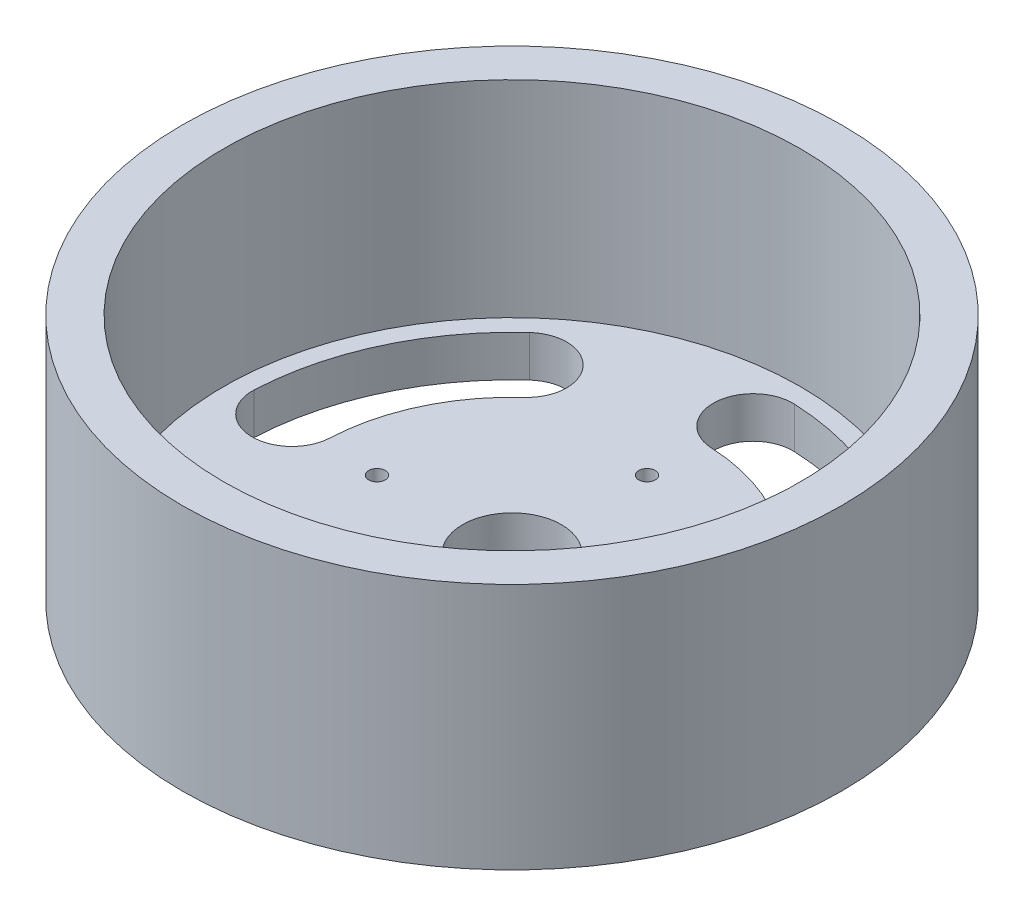
from build123d import *

# Parameters (mm, degrees)
SKETCH1_R           = 40
BOSS_EXTRUDE1_DEPTH = 30
SKETCH2_R           = 35
CUT_EXTRUDE1_DEPTH  = 25
CUT_EXTRUDE2_REACH  = 66.031
SKETCH4_R           = 6
SKETCH4_R_2         = 1


with BuildPart() as part:
    # Sketch1 → Boss-Extrude1 (new body)
    with BuildSketch(Plane(origin=(0, 0, 0), x_dir=(1, 0, 0), z_dir=(0, 1, 0))):
        with Locations(Location((0, 0, 0), (0, 0, 270))):
            Circle(SKETCH1_R)
    extrude(amount=BOSS_EXTRUDE1_DEPTH)

    # Sketch2 → Cut-Extrude1 (cut)
    with BuildSketch(Plane(origin=(0, 30, 0), x_dir=(1, 0, 0), z_dir=(0, 1, 0))):
        with Locations(Location((0, 0, 0), (0, 0, 270))):
            Circle(SKETCH2_R)
    extrude(amount=-CUT_EXTRUDE1_DEPTH, mode=Mode.SUBTRACT)

    # Sketch4 → Cut-Extrude2 (cut, up to next)
    with BuildSketch(Plane.XZ, mode=Mode.PRIVATE) as cut_extrude2_sk1:
        with Locations(Location((0, 0, 0), (0, 0, 270))):
            Circle(SKETCH4_R)
    cut_extrude2_tool1 = extrude(cut_extrude2_sk1.sketch, amount=-CUT_EXTRUDE2_REACH, mode=Mode.PRIVATE) & part.part
    # Sketch4 → Cut-Extrude2 (cut, up to next)
    with BuildSketch(Plane.XZ, mode=Mode.PRIVATE) as cut_extrude2_sk2:
        with Locations(Location((0, 16.383, 0), (0, 0, 270))):
            Circle(SKETCH4_R_2)
    cut_extrude2_tool2 = extrude(cut_extrude2_sk2.sketch, amount=-CUT_EXTRUDE2_REACH, mode=Mode.PRIVATE) & part.part
    # Sketch4 → Cut-Extrude2 (cut, up to next)
    with BuildSketch(Plane.XZ, mode=Mode.PRIVATE) as cut_extrude2_sk3:
        with Locations(Location((-16.383, 0, 0), (0, 0, 270))):
            Circle(SKETCH4_R_2)
    cut_extrude2_tool3 = extrude(cut_extrude2_sk3.sketch, amount=-CUT_EXTRUDE2_REACH, mode=Mode.PRIVATE) & part.part
    # Sketch4 → Cut-Extrude2 (cut, up to next)
    with BuildSketch(Plane.XZ, mode=Mode.PRIVATE) as cut_extrude2_sk4:
        with Locations(Location((16.383, 0, 0), (0, 0, 270))):
            Circle(SKETCH4_R_2)
    cut_extrude2_tool4 = extrude(cut_extrude2_sk4.sketch, amount=-CUT_EXTRUDE2_REACH, mode=Mode.PRIVATE) & part.part
    # Sketch4 → Cut-Extrude2 (cut, up to next)
    with BuildSketch(Plane.XZ, mode=Mode.PRIVATE) as cut_extrude2_sk5:
        with Locations(Location((0, -16.383, 0), (0, 0, 270))):
            Circle(SKETCH4_R_2)
    cut_extrude2_tool5 = extrude(cut_extrude2_sk5.sketch, amount=-CUT_EXTRUDE2_REACH, mode=Mode.PRIVATE) & part.part
    # Sketch4 → Cut-Extrude2 (cut, up to next)
    with BuildSketch(Plane.XZ, mode=Mode.PRIVATE) as cut_extrude2_sk6:
        with BuildLine():
            ThreePointArc((-1.496156575, 32.793473919), (-13.931787596, 29.72466502), (-24.246430247, 22.130545327))
            ThreePointArc((-24.246430247, 22.130545327), (-23.9352707, 15.31040186), (-17.115127233, 15.621561407))
            ThreePointArc((-17.115127233, 15.621561407), (-9.834203009, 20.982116485), (-1.056110524, 23.148334531))
            ThreePointArc((-1.056110524, 23.148334531), (3.546436145, 28.190927251), (-1.496156575, 32.793473919))
        make_face()
    cut_extrude2_tool6 = extrude(cut_extrude2_sk6.sketch, amount=-CUT_EXTRUDE2_REACH, mode=Mode.PRIVATE) & part.part
    # Sketch4 → Cut-Extrude2 (cut, up to next)
    with BuildSketch(Plane.XZ, mode=Mode.PRIVATE) as cut_extrude2_sk7:
        with BuildLine():
            ThreePointArc((32.793473919, 1.496156575), (29.72466502, 13.931787596), (22.130545327, 24.246430247))
            ThreePointArc((22.130545327, 24.246430247), (15.31040186, 23.9352707), (15.621561407, 17.115127233))
            ThreePointArc((15.621561407, 17.115127233), (20.982116485, 9.834203009), (23.148334531, 1.056110524))
            ThreePointArc((23.148334531, 1.056110524), (28.190927251, -3.546436145), (32.793473919, 1.496156575))
        make_face()
    cut_extrude2_tool7 = extrude(cut_extrude2_sk7.sketch, amount=-CUT_EXTRUDE2_REACH, mode=Mode.PRIVATE) & part.part
    # Sketch4 → Cut-Extrude2 (cut, up to next)
    with BuildSketch(Plane.XZ, mode=Mode.PRIVATE) as cut_extrude2_sk8:
        with BuildLine():
            ThreePointArc((1.496156575, -32.793473919), (13.931787596, -29.72466502), (24.246430247, -22.130545327))
            ThreePointArc((24.246430247, -22.130545327), (23.9352707, -15.31040186), (17.115127233, -15.621561407))
            ThreePointArc((17.115127233, -15.621561407), (9.834203009, -20.982116485), (1.056110524, -23.148334531))
            ThreePointArc((1.056110524, -23.148334531), (-3.546436145, -28.190927251), (1.496156575, -32.793473919))
        make_face()
    cut_extrude2_tool8 = extrude(cut_extrude2_sk8.sketch, amount=-CUT_EXTRUDE2_REACH, mode=Mode.PRIVATE) & part.part
    # Sketch4 → Cut-Extrude2 (cut, up to next)
    with BuildSketch(Plane.XZ, mode=Mode.PRIVATE) as cut_extrude2_sk9:
        with BuildLine():
            ThreePointArc((-32.793473919, -1.496156575), (-29.72466502, -13.931787596), (-22.130545327, -24.246430247))
            ThreePointArc((-22.130545327, -24.246430247), (-15.31040186, -23.9352707), (-15.621561407, -17.115127233))
            ThreePointArc((-15.621561407, -17.115127233), (-20.982116485, -9.834203009), (-23.148334531, -1.056110524))
            ThreePointArc((-23.148334531, -1.056110524), (-28.190927251, 3.546436145), (-32.793473919, -1.496156575))
        make_face()
    cut_extrude2_tool9 = extrude(cut_extrude2_sk9.sketch, amount=-CUT_EXTRUDE2_REACH, mode=Mode.PRIVATE) & part.part
    add(cut_extrude2_tool1.solids().sort_by_distance((0, 0, 0))[0], mode=Mode.SUBTRACT)
    add(cut_extrude2_tool2.solids().sort_by_distance((0, 0, 16.383))[0], mode=Mode.SUBTRACT)
    add(cut_extrude2_tool3.solids().sort_by_distance((-16.383, 0, 0))[0], mode=Mode.SUBTRACT)
    add(cut_extrude2_tool4.solids().sort_by_distance((16.383, 0, 0))[0], mode=Mode.SUBTRACT)
    add(cut_extrude2_tool5.solids().sort_by_distance((0, 0, -16.383))[0], mode=Mode.SUBTRACT)
    add(cut_extrude2_tool6.solids().sort_by_distance((-11.425701, 0, 24.377715))[0], mode=Mode.SUBTRACT)
    add(cut_extrude2_tool7.solids().sort_by_distance((24.377715, 0, 11.425701))[0], mode=Mode.SUBTRACT)
    add(cut_extrude2_tool8.solids().sort_by_distance((11.425701, 0, -24.377715))[0], mode=Mode.SUBTRACT)
    add(cut_extrude2_tool9.solids().sort_by_distance((-24.377715, 0, -11.425701))[0], mode=Mode.SUBTRACT)


solid = part.part
